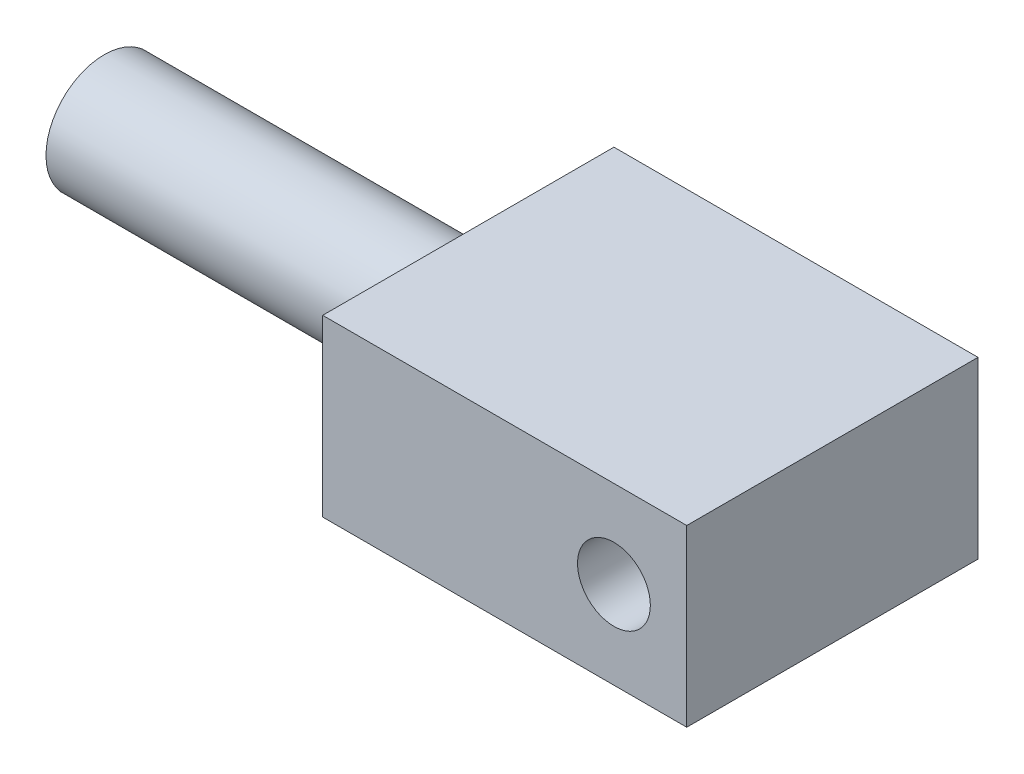
from build123d import *

# Parameters (mm, degrees)
SKETCH_1_W          = 20
SKETCH_1_H          = 12
EXTRUDE_1_DEPTH     = 25
SKETCH_5_R          = 2.5
CUT_EXTRUDE_2_DEPTH = 57.563315968
SKETCH1_R           = 4
BOSS_EXTRUDE1_DEPTH = 25


with BuildPart() as part:
    # Эскиз1 → Вытянуть1 (new body)
    with BuildSketch(Plane(origin=(0, 0, 0), x_dir=(0, 0, -1), z_dir=(1, 0, 0))):
        with Locations((-10, -40.630555576)):
            Rectangle(SKETCH_1_W, SKETCH_1_H)
    extrude(amount=EXTRUDE_1_DEPTH)

    # Эскиз5 → Вырез-Вытянуть2 (cut, through all)
    with BuildSketch(Plane.XY.offset(20)):
        with Locations((20, -40.630555576)):
            Circle(SKETCH_5_R)
    extrude(amount=-CUT_EXTRUDE_2_DEPTH, mode=Mode.SUBTRACT)

    # Sketch1 → Boss-Extrude1 (add)
    with BuildSketch(Plane.ZY):
        with Locations(Location((10, -40.630555576, 0), (0, 0, 180))):
            Circle(SKETCH1_R)
    extrude(amount=BOSS_EXTRUDE1_DEPTH)


solid = part.part
